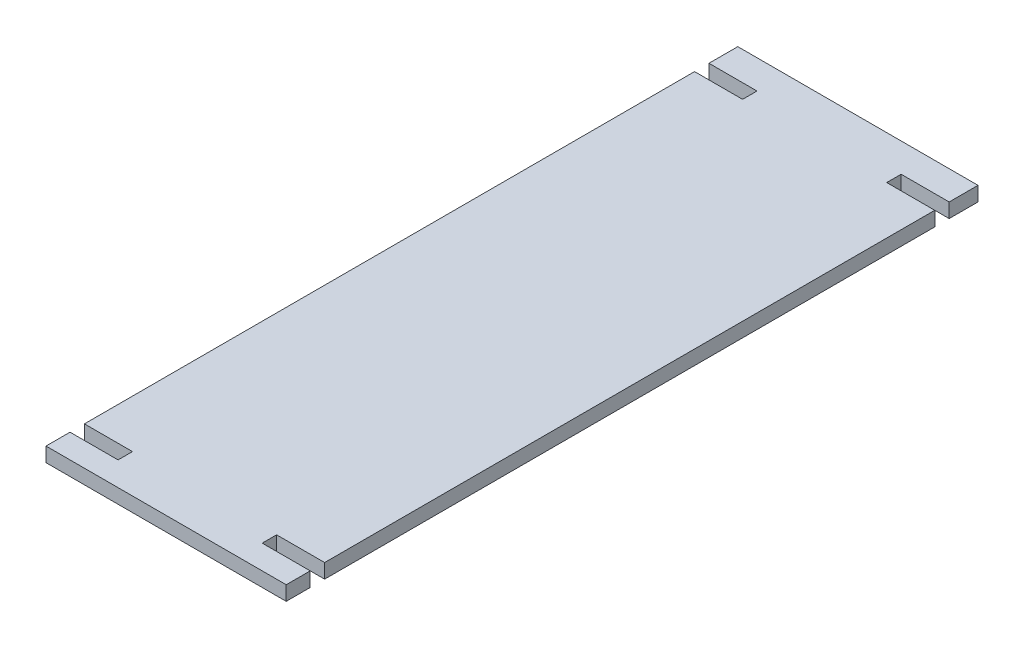
from build123d import *

# Parameters (mm, degrees)
SKETCH1_W            = 100
SKETCH1_H            = 288
BOSS_EXTRUDE1_DEPTH  = 6
SKETCH2_W            = 20
SKETCH2_H            = 6
CUT_EXTRUDE1_DEPTH   = 305.926220585
LPATTERN1_COUNT      = 2
LPATTERN1_PITCH      = 260
LPATTERN1_COUNT_DIR2 = 2
LPATTERN1_PITCH_DIR2 = 80


with BuildPart() as part:
    # Sketch1 → Boss-Extrude1 (new body)
    with BuildSketch(Plane(origin=(0, 0, 0), x_dir=(1, 0, 0), z_dir=(0, 1, 0))):
        with Locations((-50, 144)):
            Rectangle(SKETCH1_W, SKETCH1_H)
    extrude(amount=BOSS_EXTRUDE1_DEPTH)

    # Sketch2 → Cut-Extrude1 (cut, through all)
    with BuildSketch(Plane(origin=(0, 6, 0), x_dir=(1, 0, 0), z_dir=(0, 1, 0))):
        with Locations((-90, 273)):
            Rectangle(SKETCH2_W, SKETCH2_H)
    cut_extrude1 = extrude(amount=-CUT_EXTRUDE1_DEPTH, mode=Mode.SUBTRACT)

    # LPattern1: Cut-Extrude1 2 × 2
    with Locations(*[(j * LPATTERN1_PITCH_DIR2, 0, i * LPATTERN1_PITCH) for i in range(LPATTERN1_COUNT) for j in range(LPATTERN1_COUNT_DIR2) if (i, j) != (0, 0)]):
        add(cut_extrude1, mode=Mode.SUBTRACT)


solid = part.part
